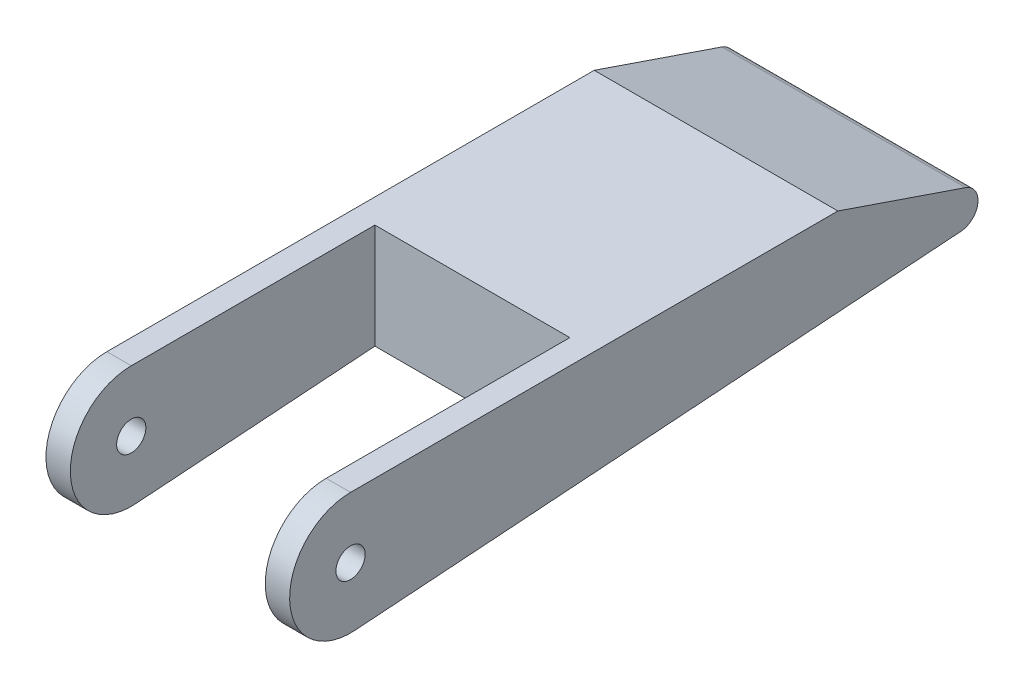
from build123d import *

# Parameters (mm, degrees)
SKETCH1_R              = 2.4
ARM_DEPTH              = 20
ELBOW_MOUNT_DEPTH      = 106.399240984
ELBOW_MOUNT_DEPTH_BACK = 106.399240984
SKETCH2_W              = 32
SKETCH2_H              = 50


with BuildPart() as part:
    # Sketch1 → arm (new, symmetric)
    with BuildSketch(Plane(origin=(0, 0, 0), x_dir=(0, 0, -1), z_dir=(1, 0, 0))):
        with BuildLine():
            Line((0, 10), (80, 10))
            Line((80, 10), (100.969511188, 2.839022377))
            ThreePointArc((100.969511188, 2.839022377), (102.974875799, -0.387445454), (100.21, -2.992640974))
            Line((100.21, -2.992640974), (80, -4.410819779))
            Line((80, -4.410819779), (0.7, -9.975469914))
            ThreePointArc((0.7, -9.975469914), (-9.993865597, -0.350214836), (0, 10))
        make_face()
        Circle(SKETCH1_R, mode=Mode.SUBTRACT)
    extrude(amount=ARM_DEPTH, both=True)

    # Sketch2 → elbow mount (cut, two sides: drawn at the far end of the back side and taken through both)
    with BuildSketch(Plane(origin=(0, 0, 0), x_dir=(1, 0, 0), z_dir=(0, 1, 0)).offset(-ELBOW_MOUNT_DEPTH_BACK)):
        with Locations((0, 15)):
            Rectangle(SKETCH2_W, SKETCH2_H)
    extrude(amount=ELBOW_MOUNT_DEPTH + ELBOW_MOUNT_DEPTH_BACK, mode=Mode.SUBTRACT)


solid = part.part
